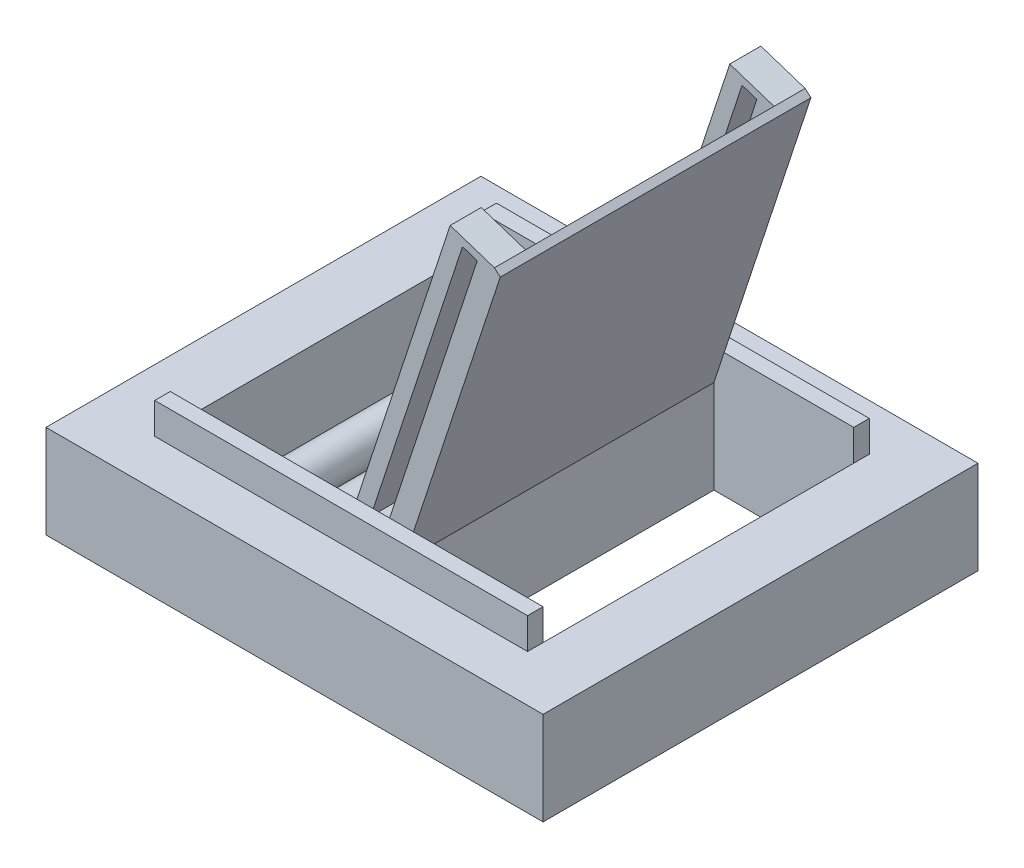
from build123d import *

# Parameters (mm, degrees)
SKETCH1_W            = 812.8
SKETCH1_H            = 711.2
BOSS_EXTRUDE1_DEPTH  = 152.4
SKETCH2_W            = 609.6
SKETCH2_H            = 508
CUT_EXTRUDE1_DEPTH   = 152.4
SKETCH4_R            = 31.75
BOSS_EXTRUDE3_DEPTH  = 508
BOSS_EXTRUDE4_DEPTH  = 508
SKETCH7_R            = 31.75
BOSS_EXTRUDE5_DEPTH  = 508
BOSS_EXTRUDE6_DEPTH  = 508
BOSS_EXTRUDE7_DEPTH  = 508
SKETCH11_W           = 50.8
SKETCH11_H           = 508
BOSS_EXTRUDE8_DEPTH  = 76.2
CUT_EXTRUDE2_DEPTH   = 508
SKETCH14_W           = 609.6
SKETCH14_H           = 25.4
BOSS_EXTRUDE10_DEPTH = 50.8
SKETCH15_R           = 31.75
BOSS_EXTRUDE11_DEPTH = 508


with BuildPart() as part:
    # Sketch1 → Boss-Extrude1 (new body)
    with BuildSketch(Plane(origin=(0, 0, 0), x_dir=(1, 0, 0), z_dir=(0, 1, 0))):
        with Locations((406.4, -355.6)):
            Rectangle(SKETCH1_W, SKETCH1_H)
    extrude(amount=BOSS_EXTRUDE1_DEPTH)

    # Sketch2 → Cut-Extrude1 (cut)
    with BuildSketch(Plane(origin=(0, 152.4, 0), x_dir=(1, 0, 0), z_dir=(0, 1, 0))):
        with Locations((406.4, -355.6)):
            Rectangle(SKETCH2_W, SKETCH2_H)
    extrude(amount=-CUT_EXTRUDE1_DEPTH, mode=Mode.SUBTRACT)

    # Sketch4 → Boss-Extrude3 (add)
    with BuildSketch(Plane.XY.offset(101.6)):
        with Locations(Location((152.4, 25.4, 0), (0, 0, 233.130102354))):
            Circle(SKETCH4_R)
    extrude(amount=BOSS_EXTRUDE3_DEPTH)

    # Sketch6 → Boss-Extrude4 (add)
    with BuildSketch(Plane.XY.offset(101.6)):
        with BuildLine():
            Line((373.396614636, 28.575), (482.6, 152.4))
            Line((482.6, 152.4), (482.6, 0))
            Line((482.6, 0), (386.295833398, 0))
            ThreePointArc((386.295833398, 0), (382.921614636, 15.675781238), (373.396614636, 28.575))
        make_face()
    extrude(amount=BOSS_EXTRUDE4_DEPTH)

    # Sketch7 → Boss-Extrude5 (add)
    with BuildSketch(Plane.XY.offset(101.6)):
        with Locations(Location((348.195833398, 0, 0), (0, 0, 180))):
            Circle(SKETCH7_R)
    extrude(amount=BOSS_EXTRUDE5_DEPTH)

    # Sketch8 → Boss-Extrude6 (add)
    with BuildSketch(Plane.XY.offset(101.6)):
        Polygon((373.396614636, 28.575), (363.871614636, 36.975260413), (473.075, 160.800260413), (482.6, 152.4), align=None)
    extrude(amount=BOSS_EXTRUDE6_DEPTH)

    # Sketch9 → Boss-Extrude7 (add)
    with BuildSketch(Plane.XY.offset(609.6)):
        Polygon((482.6, 152.4), (641.222949159, 635), (631.697949159, 643.400260413), (473.075, 160.800260413), align=None)
    extrude(amount=-BOSS_EXTRUDE7_DEPTH)

    # Sketch11 → Boss-Extrude8 (add)
    with BuildSketch(Plane(origin=(379.25081554, -124.653714944, 0), x_dir=(0, 0, 1), z_dir=(-0.95, 0.3122498999199199, 0))):
        with Locations((584.2, 554.477868797)):
            Rectangle(SKETCH11_W, SKETCH11_H)
        with Locations((127, 554.477868797)):
            Rectangle(SKETCH11_W, SKETCH11_H)
    extrude(amount=BOSS_EXTRUDE8_DEPTH)

    # Sketch12 → Cut-Extrude2 (cut)
    with BuildSketch(Plane(origin=(0, 0, 101.6), x_dir=(-1, 0, 0), z_dir=(0, 0, -1))):
        Polygon((-579.47237543, 647.197555329), (-429.198002543, 189.997555329), (-453.328002543, 182.066407871), (-603.60237543, 639.266407871), align=None)
    extrude(amount=-CUT_EXTRUDE2_DEPTH, mode=Mode.SUBTRACT)

    # Sketch14 → Boss-Extrude10 (add)
    with BuildSketch(Plane(origin=(0, 152.4, 0), x_dir=(1, 0, 0), z_dir=(0, 1, 0))):
        with Locations((406.4, -88.9)):
            Rectangle(SKETCH14_W, SKETCH14_H)
        with Locations((406.4, -622.3)):
            Rectangle(SKETCH14_W, SKETCH14_H)
    extrude(amount=BOSS_EXTRUDE10_DEPTH)

    # Sketch15 → Boss-Extrude11 (add)
    with BuildSketch(Plane(origin=(0, 0, 609.6), x_dir=(-1, 0, 0), z_dir=(0, 0, -1))):
        with Locations(Location((-342.9, 127, 0), (0, 0, 180))):
            Circle(SKETCH15_R)
    extrude(amount=BOSS_EXTRUDE11_DEPTH)


solid = part.part
